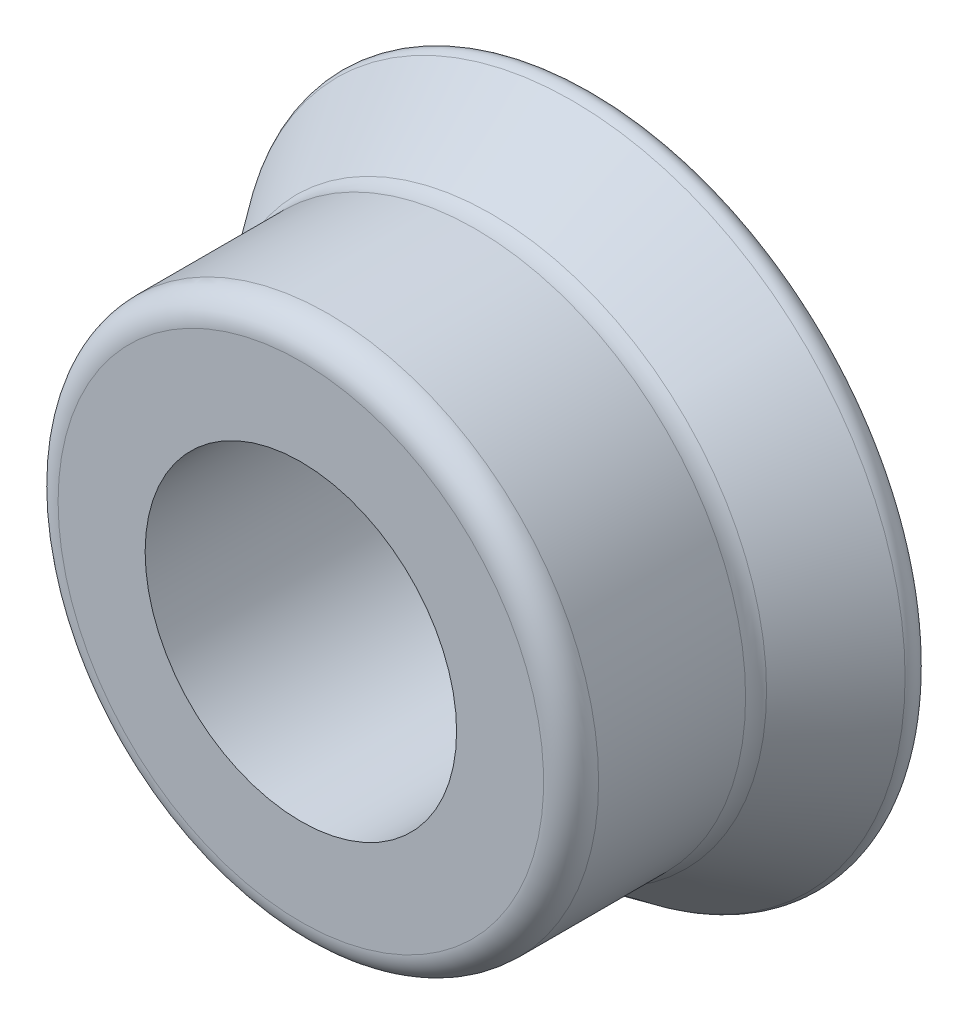
from build123d import *

# Parameters (mm, degrees)
HOLE_WIZARD_M3_1_D           = 3.4
HOLE_WIZARD_M3_1_CBORE_D     = 9
HOLE_WIZARD_M3_1_CBORE_DEPTH = 0.5
FILLET_2_R                   = 0.3


with BuildPart() as part:
    # 草图1 → 旋转1 (revolve)
    with BuildSketch(Plane(origin=(0, 0, 0), x_dir=(0, 0, -1), z_dir=(1, 0, 0)), mode=Mode.PRIVATE) as revolve_1_sk:
        with BuildLine():
            Line((0, 0), (0, -3.509931985))
            ThreePointArc((0, -3.509931985), (-0.081099311, -3.643171225), (-0.236702601, -3.632335658))
            Line((-0.236702601, -3.632335658), (-1.122080957, -3.005192656))
            ThreePointArc((-1.122080957, -3.005192656), (-1.204497707, -2.964130971), (-1.295486159, -2.95))
            Line((-1.295486159, -2.95), (-3.4, -2.95))
            ThreePointArc((-3.4, -2.95), (-3.612132034, -2.862132034), (-3.7, -2.65))
            Line((-3.7, -2.65), (-3.7, 0))
            Line((-3.7, 0), (0, 0))
        make_face()
    revolve(revolve_1_sk.sketch.rotate(Axis((0, 0, 0), (0, 0, 1)), 270), axis=Axis((0, 0, 0), (0, 0, 1)))

    # M3 六角头螺栓的柱形沉头孔1 (through all)
    with Locations(Plane.XY.offset(3.7)):
        with Locations((0, 0)):
            CounterBoreHole(HOLE_WIZARD_M3_1_D / 2, HOLE_WIZARD_M3_1_CBORE_D / 2, HOLE_WIZARD_M3_1_CBORE_DEPTH)

    # 圆角2
    fillet_2_edges = [part.edges().sort_by_distance(p)[0] for p in [
        (2.95, 0, 3.2),
    ]]
    fillet(fillet_2_edges, radius=FILLET_2_R)


solid = part.part
